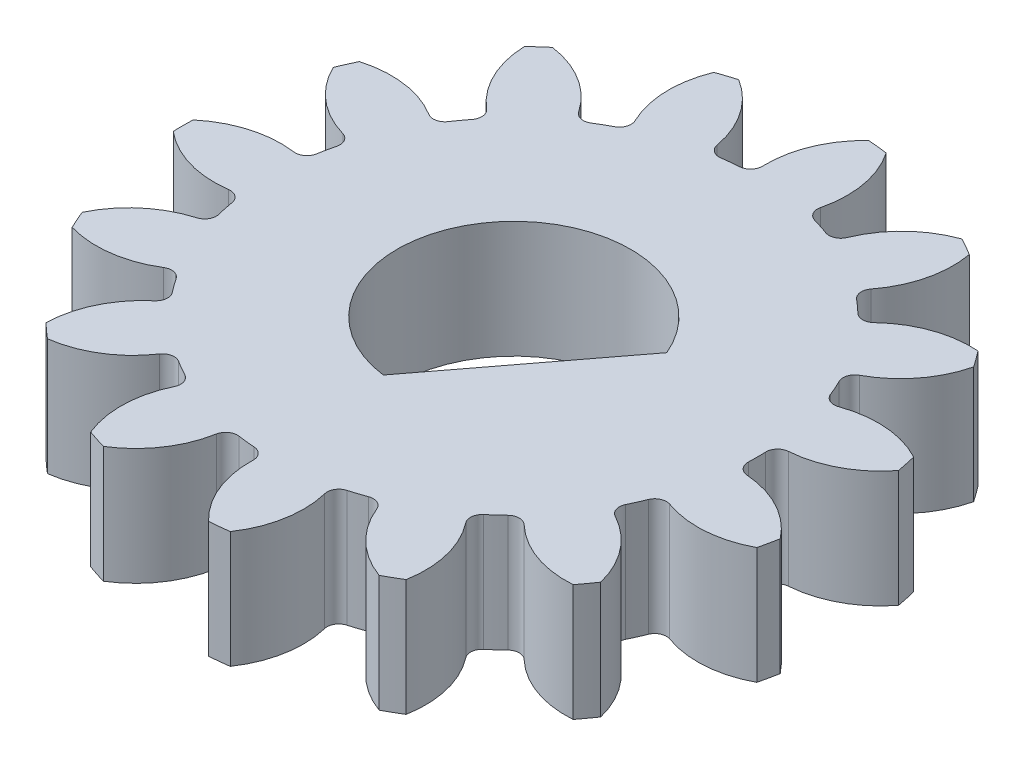
from build123d import *

# Parameters (mm, degrees)
SALIENTE_EXTRUIR1_DEPTH = 3
REDONDEO1_R             = 0.3
MATRIZC1_COUNT          = 15
REDONDEO1_OF_MATRIZC1_R = 0.3
CORTAR_EXTRUIR1_DEPTH   = 10


with BuildPart() as part:
    # Croquis3 → Saliente-Extruir1 (new body)
    with BuildSketch(Plane(origin=(0, 0, 0), x_dir=(1, 0, 0), z_dir=(0, 1, 0))):
        with BuildLine():
            ThreePointArc((1.14235078, 8.422887551), (0.89012, 8.453264836), (0.637094049, 8.476090559))
            ThreePointArc((0.637094049, 8.476090559), (-0.015804983, 7.455295958), (-0.127307813, 6.248703283))
            ThreePointArc((-0.127307813, 6.248703283), (-0.6545, -6.215635909), (1.426048321, 6.085136497))
            ThreePointArc((1.426048321, 6.085136497), (1.568310346, 7.288490261), (1.14235078, 8.422887551))
        make_face()
    saliente_extruir1 = extrude(amount=SALIENTE_EXTRUIR1_DEPTH)

    # Redondeo1
    redondeo1_edges = [part.edges().sort_by_distance(p)[0] for p in [
        (1.426048321, 1.5, -6.085136497),
        (-0.127307813, 1.5, -6.248703283),
    ]]
    fillet(redondeo1_edges, radius=REDONDEO1_R)

    # MatrizC1: Saliente-Extruir1 ×15 about axis
    matrizc1_axis = Axis((0, 0, 0), (0, 1, 0))
    for i in range(1, MATRIZC1_COUNT):
        add(saliente_extruir1.rotate(matrizc1_axis, i * 360 / MATRIZC1_COUNT))

    # Redondeo1 of MatrizC1
    redondeo1_of_matrizc1_edges = [part.edges().sort_by_distance(p)[0] for p in [
        (-1.172288025, 1.5, -6.139074913),
        (-2.657878072, 1.5, -5.656693748),
        (-3.567925122, 1.5, -5.131511505),
        (-4.728877065, 1.5, -4.086590474),
        (-5.346635552, 1.5, -3.236663139),
        (-5.982210254, 1.5, -1.809878582),
        (-6.200864122, 1.5, -0.782166312),
        (-6.201164943, 1.5, 0.779777759),
        (-5.982906952, 1.5, 1.807574175),
        (-5.347881877, 1.5, 3.234603442),
        (-4.730450818, 1.5, 4.084768667),
        (-3.569901451, 1.5, 5.130136804),
        (-2.660056762, 1.5, 5.655669547),
        (-1.174652633, 1.5, 6.138622907),
        (-0.129714726, 1.5, 6.248653782),
        (1.423704297, 1.5, 6.085685341),
        (2.423056165, 1.5, 5.761189011),
        (3.77588982, 1.5, 4.980477494),
        (4.556858631, 1.5, 4.277562322),
        (5.475189691, 1.5, 3.014099841),
        (5.902738843, 1.5, 2.054306246),
        (6.227779523, 1.5, 0.526556944),
        (6.227981884, 1.5, -0.524158042),
        (5.903529698, 1.5, -2.052032433),
        (5.476350278, 1.5, -3.011990643),
        (4.558505956, 1.5, -4.27580676),
        (3.777807957, 1.5, -4.979022699),
        (2.425275122, 1.5, -5.760255253),
    ]]
    fillet(redondeo1_of_matrizc1_edges, radius=REDONDEO1_OF_MATRIZC1_R)

    # Croquis5 → Cortar-Extruir1 (cut)
    with BuildSketch(Plane.XZ):
        with BuildLine():
            Line((2.766010172, -1.161545405), (2.404241373, -0.685290756))
            Line((2.404241373, -0.685290756), (-0.015308458, 2.49995313))
            Line((-0.015308458, 2.49995313), (-0.377077257, 2.976207779))
            ThreePointArc((-0.377077257, 2.976207779), (-2.388932915, -1.814662373), (2.766010172, -1.161545405))
        make_face()
    extrude(amount=-CORTAR_EXTRUIR1_DEPTH, mode=Mode.SUBTRACT)


solid = part.part
